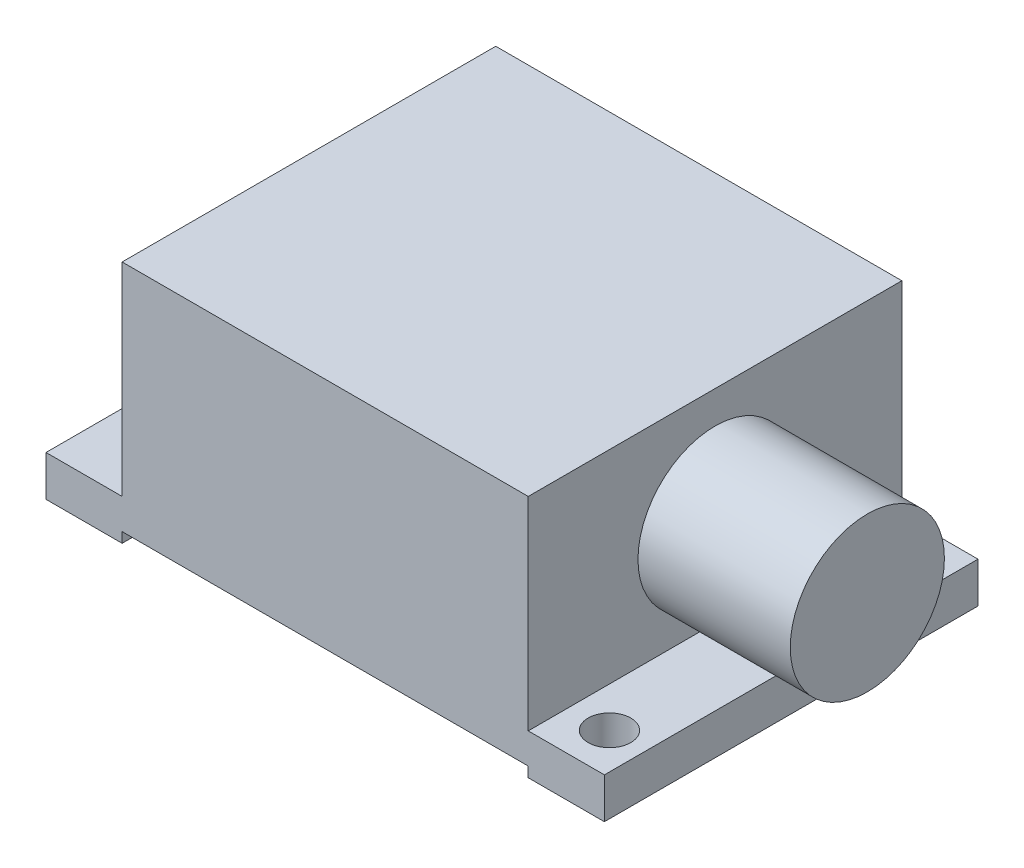
from build123d import *

# Parameters (mm, degrees)
SKETCH_1_W          = 55
SKETCH_1_H          = 36.8
EXTRUDE_1_DEPTH     = 4
SKETCH_2_W          = 40
SKETCH_2_H          = 36.8
EXTRUDE_2_DEPTH     = 20
SKETCH_3_W          = 40
SKETCH_3_H          = 2
CUT_EXTRUDE_1_DEPTH = 200
SKETCH_4_R          = 2.1
CUT_EXTRUDE_2_DEPTH = 200
SKETCH_5_R          = 7.591855359
EXTRUDE_3_DEPTH     = 15


with BuildPart() as part:
    # 草图1 → 凸台-拉伸1 (new body)
    with BuildSketch(Plane(origin=(0, 0, 0), x_dir=(1, 0, 0), z_dir=(0, 1, 0))):
        Rectangle(SKETCH_1_W, SKETCH_1_H)
    extrude(amount=EXTRUDE_1_DEPTH)

    # 草图2 → 凸台-拉伸2 (add)
    with BuildSketch(Plane(origin=(0, 4, 0), x_dir=(1, 0, 0), z_dir=(0, 1, 0))):
        Rectangle(SKETCH_2_W, SKETCH_2_H)
    extrude(amount=EXTRUDE_2_DEPTH)

    # 草图3 → 切除-拉伸1 (cut)
    with BuildSketch(Plane.XY.offset(18.4)):
        Rectangle(SKETCH_3_W, SKETCH_3_H)
    extrude(amount=-CUT_EXTRUDE_1_DEPTH, mode=Mode.SUBTRACT)

    # 草图4 → 切除-拉伸2 (cut)
    with BuildSketch(Plane(origin=(0, 4, 0), x_dir=(1, 0, 0), z_dir=(0, 1, 0))):
        with Locations(Location((-23.95, 0, 0), (0, 0, 270))):
            Circle(SKETCH_4_R)
        with Locations(Location((23.95, 14.35, 0), (0, 0, 270))):
            Circle(SKETCH_4_R)
        with Locations(Location((23.95, -14.35, 0), (0, 0, 270))):
            Circle(SKETCH_4_R)
    extrude(amount=-CUT_EXTRUDE_2_DEPTH, mode=Mode.SUBTRACT)

    # 草图5 → 凸台-拉伸3 (add)
    with BuildSketch(Plane(origin=(20, 0, 0), x_dir=(0, 0, -1), z_dir=(1, 0, 0))):
        with Locations(Location((0, 13.214422917, 0), (0, 0, 180))):
            Circle(SKETCH_5_R)
    extrude(amount=EXTRUDE_3_DEPTH)


solid = part.part
